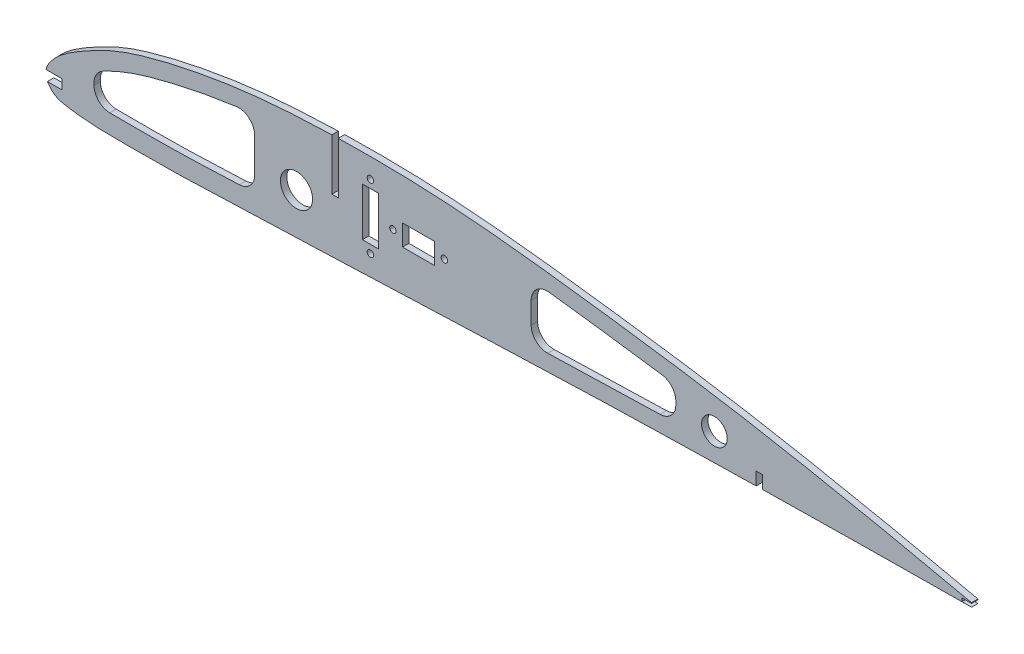
from build123d import *

# Parameters (mm, degrees)
SKETCH_1_R          = 5
SKETCH_1_R_2        = 4
EXTRUDE_1_DEPTH     = 2
SKETCH_3_R          = 1
SKETCH_3_W          = 10
SKETCH_3_H          = 6.5
SKETCH_3_W_2        = 5
SKETCH_3_H_2        = 15
CUT_EXTRUDE_2_DEPTH = 291.413778556


with BuildPart() as part:
    # 草图1 → 凸台-拉伸1 (new body)
    with BuildSketch(Plane.XY):
        with BuildLine():
            Line((90, 12.3715), (90, 28.372426217))
            add(Edge.make_bspline(
                [(90, 28.372426217), (89.259446982, 28.350928743), (82.363996343, 28.13322439), (72.403347361, 27.586524792), (60.185862052, 26.226268085), (51.080991088, 24.79810862), (42.033943524, 23.000087944), (34.581994337, 21.174922903), (28.697351661, 19.44563851), (24.361981086, 17.983441115), (20.174828998, 16.207949367), (16.078941989, 14.139912989), (12.040296713, 11.946766626), (8.14011433, 9.56039573), (5.153679337, 7.316395724), (3.100060439, 5.200618052), (1.813825976, 3.470730924), (1.237398467, 2.180506339), (1.085380705, 1.529058937), (1.078882286, 1.5)],
                knots=[0.345773533, 0.345773533, 0.345773533, 0.345773533, 0.349398211, 0.379527288, 0.394591827, 0.409656366, 0.424720905, 0.439785444, 0.447317713, 0.454849983, 0.462382252, 0.469914522, 0.477446791, 0.484979061, 0.49251133, 0.496277465, 0.5000436, 0.503809734, 0.503985678, 0.503985678, 0.503985678, 0.503985678], degree=3))
            Line((1.078882286, 1.5), (6, 1.5))
            Line((6, 1.5), (6, -1.5))
            Line((6, -1.5), (1.522379628, -1.5))
            add(Edge.make_bspline(
                [(1.522379628, -1.5), (1.617903461, -1.678770523), (2.068186491, -2.42442122), (3.143139608, -3.601090845), (4.854253, -4.619355756), (6.927567017, -5.105597911), (9.209034621, -5.454839075), (12.219971865, -5.84289763), (16.020132359, -6.14266222), (20.609524976, -6.2611368), (25.231457517, -6.286948592), (31.397380169, -6.280305851), (39.107274969, -6.240736398), (48.336813051, -6.022096429), (57.579935967, -5.612990736), (66.840654471, -5.242934226), (76.096556555, -4.921715721), (88.435998513, -4.515955408), (103.853120896, -3.973102953), (122.354625015, -3.248110744), (140.857835973, -2.495489966), (159.368527813, -1.804089638), (177.884173919, -1.222493213), (196.4033921, -0.774877257), (211.106034353, -0.46143934), (219.638958118, -0.28014938), (222, -0.231405833)],
                knots=[0.510182255, 0.510182255, 0.510182255, 0.510182255, 0.511342004, 0.515108139, 0.518874273, 0.522640408, 0.526406543, 0.530172677, 0.537704947, 0.545237216, 0.552769486, 0.560301755, 0.575366294, 0.590430833, 0.605495372, 0.620559911, 0.63562445, 0.650688989, 0.680818067, 0.710947144, 0.741076222, 0.7712053, 0.801334378, 0.831463456, 0.861592533, 0.873117312, 0.873117312, 0.873117312, 0.873117312], degree=3))
            Line((222, -0.231405833), (222, 3.768284765))
            Line((222, 3.768284765), (224, 3.768284765))
            Line((224, 3.768284765), (224, -0.190486213))
            add(Edge.make_bspline(
                [(224, -0.190486213), (227.14486696, -0.126773539), (236.463303784, 0.052517956), (251.961175933, 0.256656825), (270.471854229, 0.429163033), (282.824771355, 0.587434741), (289, 0.610062865)],
                knots=[0.8763714, 0.8763714, 0.8763714, 0.8763714, 0.891721611, 0.921850689, 0.951979767, 0.982108845, 0.982108845, 0.982108845, 0.982108845], degree=3))
            Line((289, 0.610062865), (286, 0.610062865))
            Line((286, 0.610062865), (286, 1.610062865))
            Line((286, 1.610062865), (289, 1.610062865))
            Line((289, 1.610062865), (289, 1.816246039))
            add(Edge.make_bspline(
                [(289, 1.816246039), (276.957314444, 4.502285023), (258.861554155, 8.397620333), (234.648247971, 13.152786595), (216.448478593, 16.478914183), (198.182873559, 19.371550405), (179.850571346, 21.924148488), (161.503162682, 24.358614825), (143.127892269, 26.473190985), (124.712239059, 28.043780086), (107.661076739, 28.627794226), (96.749283398, 28.541845307), (92, 28.425883181)],
                knots=[0.017978355, 0.017978355, 0.017978355, 0.017978355, 0.07823651, 0.108365588, 0.138494666, 0.168623744, 0.198752821, 0.228881899, 0.259010977, 0.289140055, 0.319269133, 0.342510787, 0.342510787, 0.342510787, 0.342510787], degree=3))
            Line((92, 28.425883181), (92, 12.3715))
            Line((92, 12.3715), (90, 12.3715))
        make_face()
        with Locations((79, 8)):
            Circle(SKETCH_1_R, mode=Mode.SUBTRACT)
        with Locations((209, 8)):
            Circle(SKETCH_1_R_2, mode=Mode.SUBTRACT)
    extrude(amount=EXTRUDE_1_DEPTH)

    # 草图3 → 切除-拉伸2 (cut, through all)
    with BuildSketch(Plane.XY):
        with Locations((109, 12.3715)):
            Circle(SKETCH_3_R)
        with Locations(Location((125, 12.3715, 0), (0, 0, 180))):
            Circle(SKETCH_3_R)
        with Locations((102, 22.3715)):
            Circle(SKETCH_3_R)
        with Locations((102, 2.3715)):
            Circle(SKETCH_3_R)
        with BuildLine():
            Line((16, 5.402967421), (16, 4.749566555))
            ThreePointArc((16, 4.749566555), (17.438114785, 1.240581842), (20.925189485, -0.249873753))
            add(Edge.make_bspline(
                [(20.925189485, -0.249873753), (22.882709708, -0.279165651), (24.840641991, -0.283525018), (29.041829536, -0.283940324), (31.285240614, -0.278329339), (38.015485271, -0.240317871), (42.502372715, -0.172195541), (51.471753165, 0.109493271), (55.953809182, 0.320868582), (60.691665275, 0.51398671), (60.94634527, 0.524299853), (61.201027705, 0.534547785)],
                knots=[0.014317845, 0.014317845, 0.014317845, 0.014317845, 0.020191056, 0.020191056, 0.026921408, 0.026921408, 0.040382112, 0.040382112, 0.053842816, 0.053842816, 0.054607483, 0.054607483, 0.054607483, 0.054607483], degree=3))
            ThreePointArc((61.201027705, 0.534547785), (64.60590755, 2.066774182), (66, 5.530504936))
            Line((66, 5.530504936), (66, 16.175207171))
            ThreePointArc((66, 16.175207171), (64.287676463, 19.942325894), (60.32352661, 21.129234195))
            add(Edge.make_bspline(
                [(60.32352661, 21.129234195), (59.143282742, 20.968071656), (57.964431768, 20.796736398), (53.109249428, 20.046773379), (49.445857595, 19.384253181), (42.158673028, 17.868714577), (38.533379611, 17.019586343), (33.148990447, 15.546220745), (31.362942012, 15.022439399), (27.821005995, 13.880218625), (26.067238608, 13.253271835), (22.635818059, 11.812670552), (20.957942753, 11.004847704), (19.099592195, 10.049689097), (18.896441621, 9.944700093), (18.693547477, 9.839213217)],
                knots=[0.029920383, 0.029920383, 0.029920383, 0.029920383, 0.033494004, 0.033494004, 0.044658672, 0.044658672, 0.05582334, 0.05582334, 0.061405674, 0.061405674, 0.066988008, 0.066988008, 0.072570342, 0.072570342, 0.073256353, 0.073256353, 0.073256353, 0.073256353], degree=3))
            ThreePointArc((18.693547477, 9.839213217), (16.726110517, 7.997937304), (16, 5.402967421))
        make_face()
        with Locations((117, 12.3715)):
            Rectangle(SKETCH_3_W, SKETCH_3_H)
        with Locations((102, 12.3715)):
            Rectangle(SKETCH_3_W_2, SKETCH_3_H_2)
        with BuildLine():
            Line((152, 14.780862449), (152, 8.10116079))
            ThreePointArc((152, 8.10116079), (153.526907054, 4.504269717), (157.175050156, 3.104225985))
            add(Edge.make_bspline(
                [(157.175050156, 3.104225985), (160.142149061, 3.208167931), (163.109842262, 3.308184708), (170.732455506, 3.552774746), (175.388689917, 3.690754395), (184.07020031, 3.924521784), (188.094738333, 4.024115619), (192.117455336, 4.118639618)],
                knots=[0.710145027, 0.710145027, 0.710145027, 0.710145027, 0.75, 0.75, 0.8125, 0.8125, 0.866546799, 0.866546799, 0.866546799, 0.866546799], degree=3))
            ThreePointArc((192.117455336, 4.118639618), (195.576819584, 5.623499462), (197, 9.117259852))
            Line((197, 9.117259852), (197, 10.112022474))
            ThreePointArc((197, 10.112022474), (195.77958016, 13.385365385), (192.714090476, 15.060767244))
            add(Edge.make_bspline(
                [(192.714090476, 15.060767244), (191.944613201, 15.171800732), (191.174825659, 15.282099728), (186.308954619, 15.974755997), (182.203786583, 16.539615577), (173.988030512, 17.653320176), (169.883033971, 18.199812389), (163.05203857, 19.07552627), (160.324682912, 19.416350788), (157.598275441, 19.744940057)],
                knots=[0.488248297, 0.488248297, 0.488248297, 0.488248297, 0.5, 0.5, 0.5625, 0.5625, 0.625, 0.625, 0.666561376, 0.666561376, 0.666561376, 0.666561376], degree=3))
            ThreePointArc((157.598275441, 19.744940057), (153.682725306, 18.521943657), (152, 14.780862449))
        make_face()
    extrude(amount=CUT_EXTRUDE_2_DEPTH, mode=Mode.SUBTRACT)


solid = part.part
